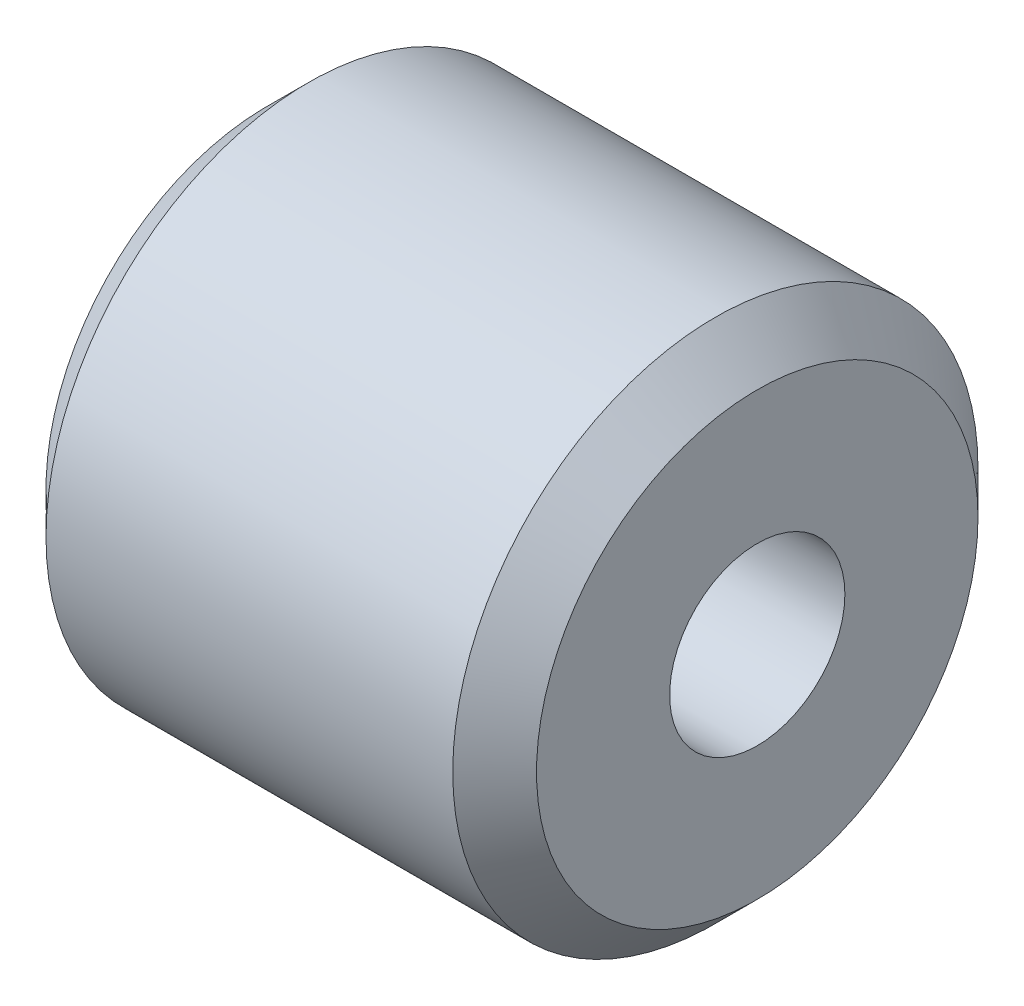
from build123d import *

# Parameters (mm, degrees)
SKETCH1_R           = 4.765
SKETCH1_R_2         = 1.59
BOSS_EXTRUDE1_DEPTH = 4.45
CHAMFER1_SIZE       = 0.76


with BuildPart() as part:
    # Sketch1 → Boss-Extrude1 (new, symmetric)
    with BuildSketch(Plane(origin=(0, 0, 0), x_dir=(0, 0, -1), z_dir=(1, 0, 0))):
        with Locations((0, 0.078183618)):
            Circle(SKETCH1_R)
        with Locations((0, 0.078183618)):
            Circle(SKETCH1_R_2, mode=Mode.SUBTRACT)
    extrude(amount=BOSS_EXTRUDE1_DEPTH, both=True)

    # Chamfer1
    chamfer1_edges = [part.edges().sort_by_distance(p)[0] for p in [
        (-4.45, 0.078183618, 4.765),
        (4.45, 0.078183618, 4.765),
    ]]
    chamfer(chamfer1_edges, length=CHAMFER1_SIZE)


solid = part.part
